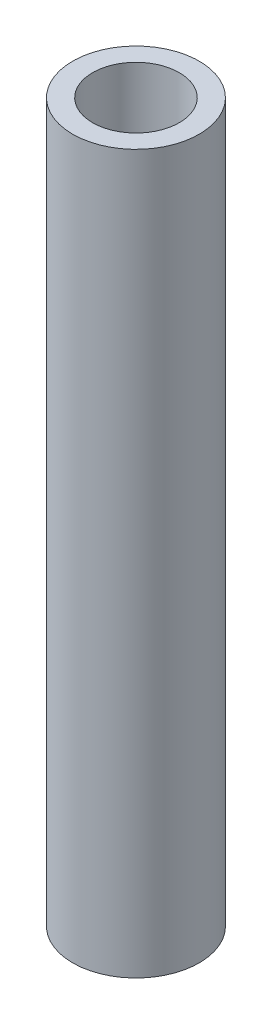
from build123d import *

# Parameters (mm, degrees)
TUBE_PROFILE_R   = 3.175
TUBE_PROFILE_R_2 = 2.175


with BuildPart() as part:
    # Tube: sweep along a curve in space
    with BuildLine() as tube_path:
        Line((-150, 127, 200), (-150, 163, 200))
    # Tube profile (on start of the path) → Tube (sweep)
    with BuildSketch(Plane(origin=(-150, 127, 200), x_dir=(0, 0, 1), z_dir=(0, 1, 0))):
        Circle(TUBE_PROFILE_R)
        Circle(TUBE_PROFILE_R_2, mode=Mode.SUBTRACT)
    sweep(path=tube_path.line)


solid = part.part
